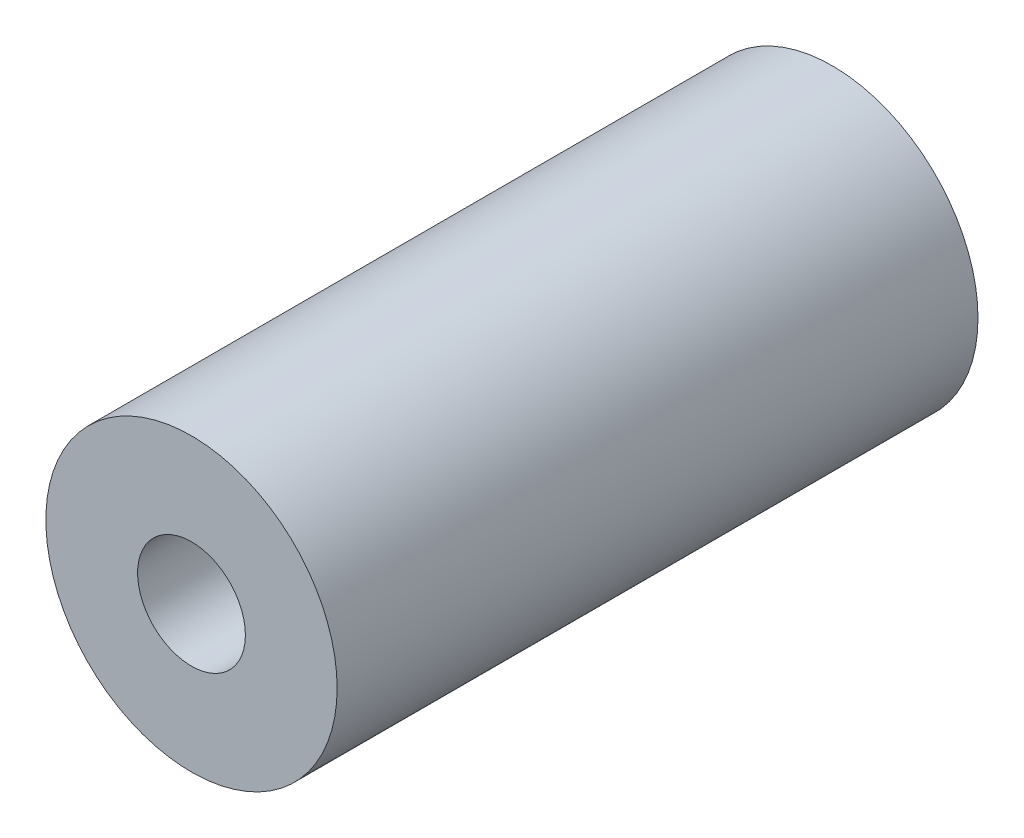
from build123d import *

# Parameters (mm, degrees)
SKETCH1_R           = 5
SKETCH1_R_2         = 1.85
BOSS_EXTRUDE1_DEPTH = 22


with BuildPart() as part:
    # Sketch1 → Boss-Extrude1 (new body)
    with BuildSketch(Plane.XY):
        Circle(SKETCH1_R)
        Circle(SKETCH1_R_2, mode=Mode.SUBTRACT)
    extrude(amount=BOSS_EXTRUDE1_DEPTH)


solid = part.part
